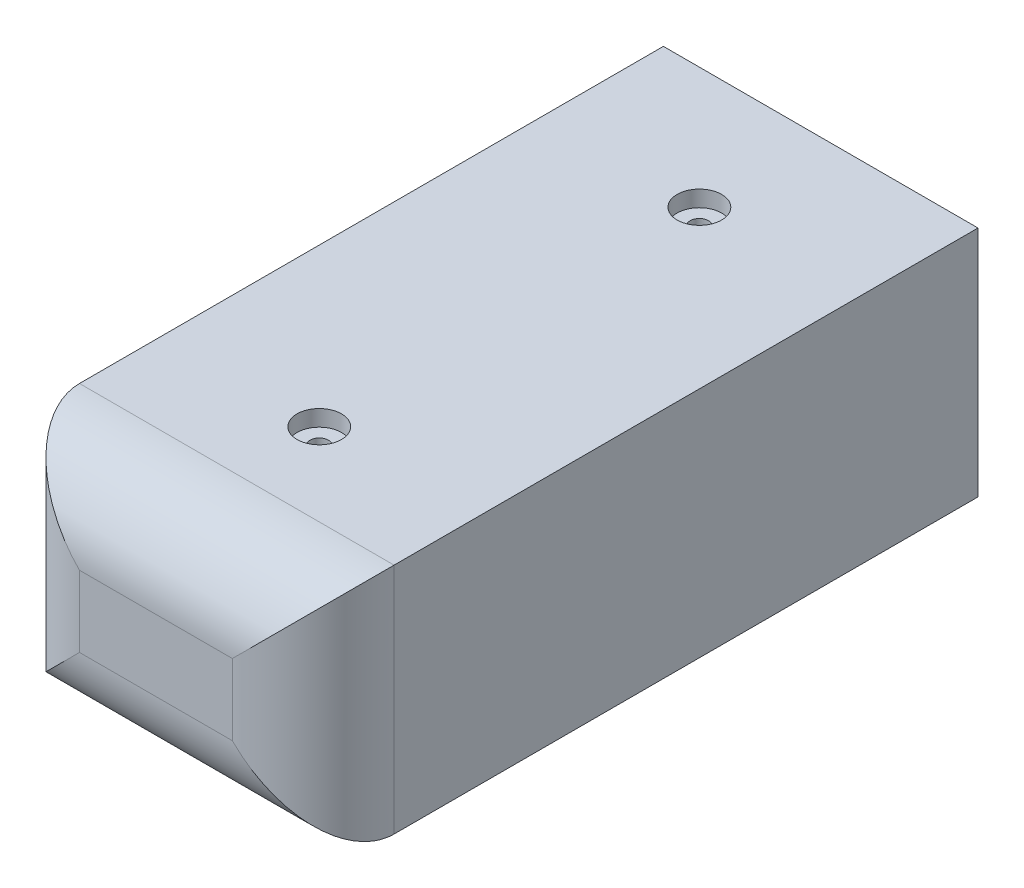
from build123d import *

# Parameters (mm, degrees)
SKIZZE1_W                                           = 155.6
SKIZZE1_H                                           = 115.2
AUFSATZ_LINEAR_AUSTRAGEN1_DEPTH                     = 328.8
SCHNITT_LINEAR_AUSTRAGEN1_DEPTH                     = 328.8
SCHNITT_LINEAR_AUSTRAGEN2_DEPTH                     = 328.8
KERNLOCH_F_R_M8X1_251_D                             = 6.8
KERNLOCH_F_R_M8X1_251_DEPTH                         = 30
KERNLOCH_F_R_M8X1_251_TIP                           = 2.042926105
STIRNSENKUNG_F_R_M8_SENKSCHRAUBE_KOPF_B_D           = 9
STIRNSENKUNG_F_R_M8_SENKSCHRAUBE_KOPF_B_CBORE_D     = 22
STIRNSENKUNG_F_R_M8_SENKSCHRAUBE_KOPF_B_CBORE_DEPTH = 8
STIRNSENKUNG_F_R_M8_SENKSCHRAUBE_KO_2_D             = 9
STIRNSENKUNG_F_R_M8_SENKSCHRAUBE_KO_2_CBORE_D       = 15
STIRNSENKUNG_F_R_M8_SENKSCHRAUBE_KO_2_CBORE_DEPTH   = 8


with BuildPart() as part:
    # Skizze1 → Aufsatz-Linear austragen1 (new body)
    with BuildSketch(Plane.XY):
        Rectangle(SKIZZE1_W, SKIZZE1_H)
    extrude(amount=AUFSATZ_LINEAR_AUSTRAGEN1_DEPTH)

    # Skizze2 → Schnitt-Linear austragen1 (cut)
    with BuildSketch(Plane(origin=(77.8, 0, 0), x_dir=(0, 0, -1), z_dir=(1, 0, 0))):
        with BuildLine():
            Line((-288.8, 57.6), (-212.381166773, 57.6))
            Line((-212.381166773, 57.6), (-328.8, 118.277888245))
            Line((-328.8, 118.277888245), (-328.8, 17.6))
            ThreePointArc((-328.8, 17.6), (-317.084271247, 45.884271247), (-288.8, 57.6))
        make_face()
    schnitt_linear_austragen1 = extrude(amount=-SCHNITT_LINEAR_AUSTRAGEN1_DEPTH, mode=Mode.SUBTRACT)

    # Spiegeln1: Schnitt-Linear austragen1 across plane
    add(schnitt_linear_austragen1.mirror(Plane.ZX), mode=Mode.SUBTRACT)

    # Skizze3 → Schnitt-Linear austragen2 (cut)
    with BuildSketch(Plane(origin=(0, 57.6, 0), x_dir=(1, 0, 0), z_dir=(0, 1, 0))):
        with BuildLine():
            Line((-77.8, -328.8), (-77.8, -288.8))
            ThreePointArc((-77.8, -288.8), (-66.084271247, -317.084271247), (-37.8, -328.8))
            Line((-37.8, -328.8), (-77.8, -328.8))
        make_face()
    schnitt_linear_austragen2 = extrude(amount=-SCHNITT_LINEAR_AUSTRAGEN2_DEPTH, mode=Mode.SUBTRACT)

    # Spiegeln2: Schnitt-Linear austragen2 across plane
    add(schnitt_linear_austragen2.mirror(Plane(origin=(0, 0, 0), x_dir=(0, 0, 1), z_dir=(1, 0, 0))), mode=Mode.SUBTRACT)

    # Kernloch für M8x1.251
    with Locations(Plane(origin=(0, 0, 0), x_dir=(-1, 0, 0), z_dir=(0, 0, -1))):
        with Locations((-47.8, 0), (47.8, 0)):
            Hole(KERNLOCH_F_R_M8X1_251_D / 2, depth=KERNLOCH_F_R_M8X1_251_DEPTH)
            with Locations((0, 0, -(KERNLOCH_F_R_M8X1_251_DEPTH + KERNLOCH_F_R_M8X1_251_TIP / 2))):  # 118° drill point
                Cone(0, KERNLOCH_F_R_M8X1_251_D / 2, KERNLOCH_F_R_M8X1_251_TIP, mode=Mode.SUBTRACT)

    # Stirnsenkung f_r M8 Senkschraube _Kopf B (through all)
    with Locations(Plane(origin=(0, 57.6, 0), x_dir=(1, 0, 0), z_dir=(0, 1, 0))):
        with Locations((0, -248), (0, -60)):
            CounterBoreHole(STIRNSENKUNG_F_R_M8_SENKSCHRAUBE_KOPF_B_D / 2, STIRNSENKUNG_F_R_M8_SENKSCHRAUBE_KOPF_B_CBORE_D / 2, STIRNSENKUNG_F_R_M8_SENKSCHRAUBE_KOPF_B_CBORE_DEPTH)

    # Stirnsenkung f_r M8 Senkschraube _Ko 2 (through all)
    with Locations(Plane(origin=(0, -57.6, 0), x_dir=(-1, 0, 0), z_dir=(0, -1, 0))):
        with Locations((0, -248), (0, -60)):
            CounterBoreHole(STIRNSENKUNG_F_R_M8_SENKSCHRAUBE_KO_2_D / 2, STIRNSENKUNG_F_R_M8_SENKSCHRAUBE_KO_2_CBORE_D / 2, STIRNSENKUNG_F_R_M8_SENKSCHRAUBE_KO_2_CBORE_DEPTH)


solid = part.part
